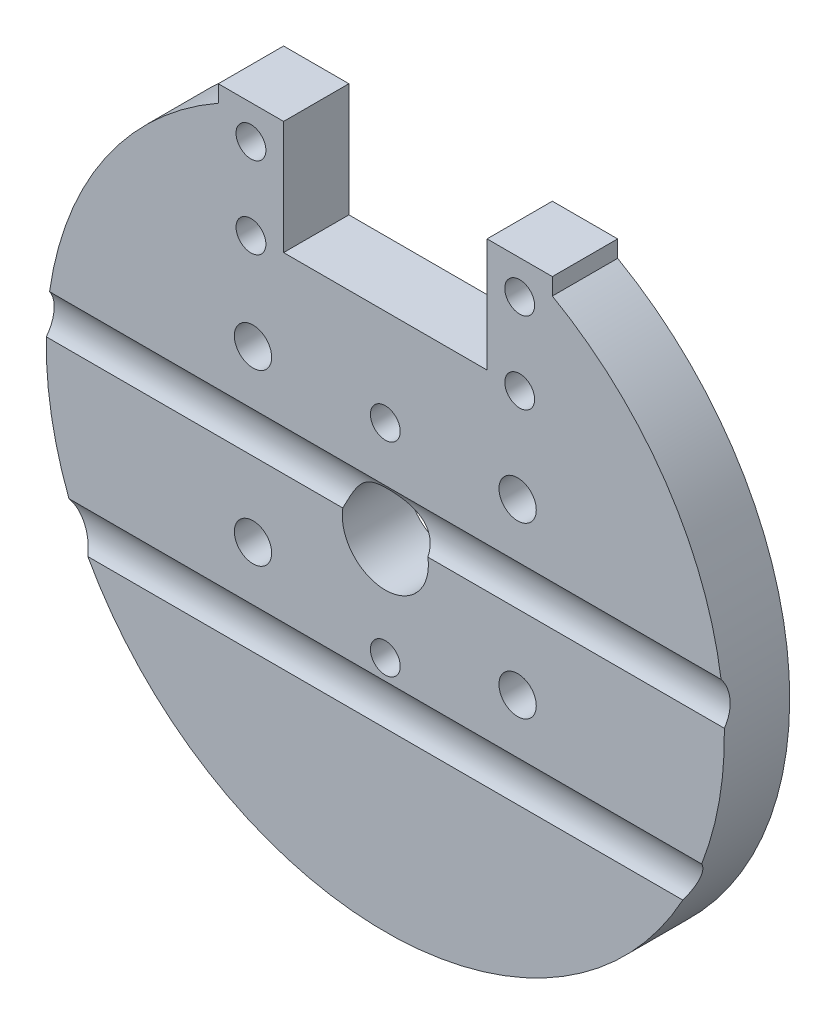
from build123d import *

# Parameters (mm, degrees)
SKETCH1_R               = 50
EXTRUDE_3_8_DEPTH       = 9.63
CUT_EXTRUDE1_DEPTH      = 9.63
SKETCH3_W               = 9.63
SKETCH3_H               = 16.75
BOSS_EXTRUDE2_DEPTH     = 9.63
SKETCH4_R               = 2.2
M4_THROUGH_DEPTH        = 9.63
SKETCH5_R               = 6.35
CUT_EXTRUDE2_DEPTH      = 9.63
SKETCH6_R               = 2.2
M4_THROUGH2_DEPTH       = 9.63
SKETCH7_R               = 2.75
M5_THROUGH_DEPTH        = 9.63
CHAMFER1_SIZE           = 2.5
CUT_EXTRUDE4_DEPTH      = 72.363414296
CUT_EXTRUDE4_DEPTH_BACK = 72.363414296
SKETCH8_R               = 5


with BuildPart() as part:
    # Sketch1 → 3/8 (new body)
    with BuildSketch(Plane.XY):
        Circle(SKETCH1_R)
    extrude(amount=EXTRUDE_3_8_DEPTH)

    # Sketch2 → Cut-Extrude1 (cut)
    with BuildSketch(Plane.XY.offset(9.63)):
        Polygon((-15, 46), (-15, 29.25), (15, 29.25), (15, 46), (28.100203936, 46), (28.100203936, 76.142415264), (-30.736146894, 76.142415264), (-30.736146894, 46), align=None)
    extrude(amount=-CUT_EXTRUDE1_DEPTH, mode=Mode.SUBTRACT)

    # Sketch3 → Boss-Extrude2 (add)
    with BuildSketch(Plane.XY.offset(9.63)):
        with Locations((-19.815, 37.625)):
            Rectangle(SKETCH3_W, SKETCH3_H)
        with Locations((19.815, 37.625)):
            Rectangle(SKETCH3_W, SKETCH3_H)
    extrude(amount=-BOSS_EXTRUDE2_DEPTH)

    # Sketch4 → M4_through (cut)
    with BuildSketch(Plane.XY.offset(9.63)):
        with Locations((-19.815, 41)):
            Circle(SKETCH4_R)
        with Locations((-19.815, 29)):
            Circle(SKETCH4_R)
        with Locations((19.815, 29)):
            Circle(SKETCH4_R)
        with Locations((19.815, 41)):
            Circle(SKETCH4_R)
    extrude(amount=-M4_THROUGH_DEPTH, mode=Mode.SUBTRACT)

    # Sketch5 → Cut-Extrude2 (cut)
    with BuildSketch(Plane.XY.offset(9.63)):
        Circle(SKETCH5_R)
    extrude(amount=-CUT_EXTRUDE2_DEPTH, mode=Mode.SUBTRACT)

    # Sketch6 → M4_through2 (cut)
    with BuildSketch(Plane.XY.offset(9.63)):
        with Locations((0, 15)):
            Circle(SKETCH6_R)
        with Locations((0, -15)):
            Circle(SKETCH6_R)
    extrude(amount=-M4_THROUGH2_DEPTH, mode=Mode.SUBTRACT)

    # Sketch7 → M5_through (cut)
    with BuildSketch(Plane.XY.offset(9.63)):
        with Locations((-19.51, 15)):
            Circle(SKETCH7_R)
        with Locations((-19.51, -10)):
            Circle(SKETCH7_R)
        with Locations((19.51, -10)):
            Circle(SKETCH7_R)
        with Locations((19.51, 15)):
            Circle(SKETCH7_R)
    extrude(amount=-M5_THROUGH_DEPTH, mode=Mode.SUBTRACT)

    # Chamfer1
    chamfer1_edges = [part.edges().sort_by_distance(p)[0] for p in [
        (17.615, 41, 0),
        (17.615, 29, 0),
        (-22.015, 29, 0),
        (-22.015, 41, 0),
    ]]
    chamfer(chamfer1_edges, length=CHAMFER1_SIZE)

    # Sketch8 → Cut-Extrude4 (cut, two sides: drawn at the far end of the back side and taken through both)
    with BuildSketch(Plane(origin=(0, 0, 0), x_dir=(0, 0, -1), z_dir=(1, 0, 0)).offset(-CUT_EXTRUDE4_DEPTH_BACK)):
        with Locations((-13.63, 4)):
            Circle(SKETCH8_R)
        with Locations((-13.63, -21)):
            Circle(SKETCH8_R)
    extrude(amount=CUT_EXTRUDE4_DEPTH + CUT_EXTRUDE4_DEPTH_BACK, mode=Mode.SUBTRACT)


solid = part.part
